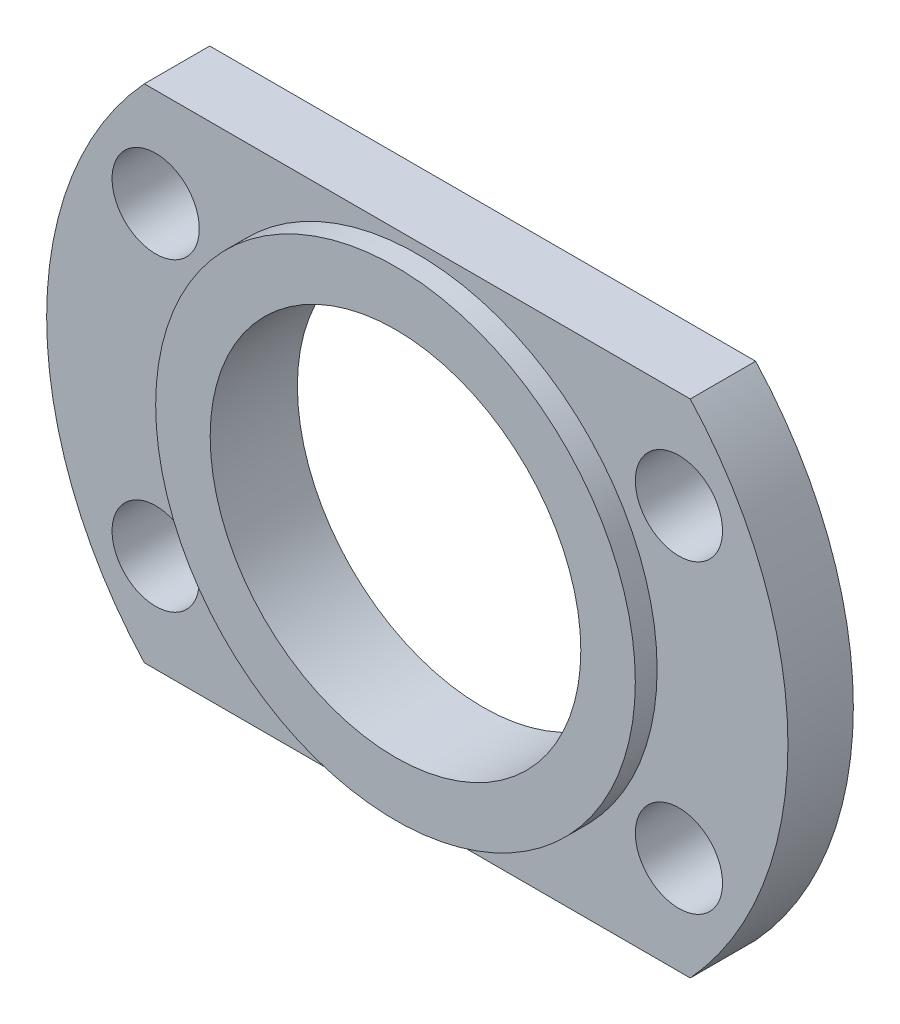
from build123d import *

# Parameters (mm, degrees)
SKETCH_1_R      = 2
SKETCH_1_R_2    = 8.5
EXTRUDE_1_DEPTH = 3
SKETCH_2_R      = 11
SKETCH_2_R_2    = 8.5
EXTRUDE_2_DEPTH = 1


with BuildPart() as part:
    # 草图1 → 凸台-拉伸1 (new body)
    with BuildSketch(Plane.XY):
        with BuildLine():
            Line((-12.519984026, -11.5), (12.519984026, -11.5))
            ThreePointArc((12.519984026, -11.5), (17, 0), (12.519984026, 11.5))
            Line((12.519984026, 11.5), (-12.519984026, 11.5))
            ThreePointArc((-12.519984026, 11.5), (-17, 0), (-12.519984026, -11.5))
        make_face()
        with Locations((-12, -7)):
            Circle(SKETCH_1_R, mode=Mode.SUBTRACT)
        with Locations((-12, 7)):
            Circle(SKETCH_1_R, mode=Mode.SUBTRACT)
        with Locations((12, 7)):
            Circle(SKETCH_1_R, mode=Mode.SUBTRACT)
        with Locations((12, -7)):
            Circle(SKETCH_1_R, mode=Mode.SUBTRACT)
        Circle(SKETCH_1_R_2, mode=Mode.SUBTRACT)
    extrude(amount=EXTRUDE_1_DEPTH)

    # 草图2 → 凸台-拉伸2 (add)
    with BuildSketch(Plane.XY.offset(3)):
        Circle(SKETCH_2_R)
        Circle(SKETCH_2_R_2, mode=Mode.SUBTRACT)
    extrude(amount=EXTRUDE_2_DEPTH)


solid = part.part
